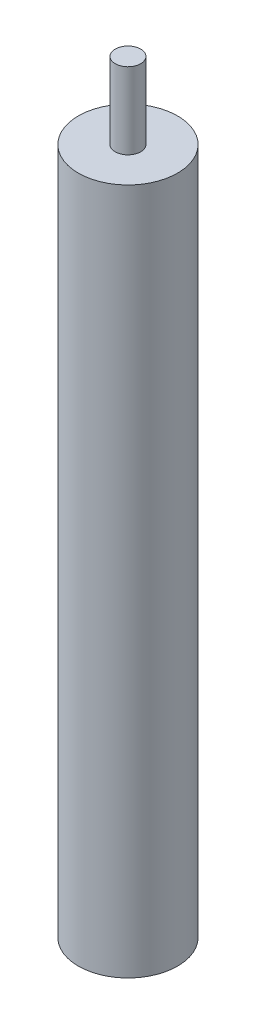
from build123d import *

# Parameters (mm, degrees)
SKETCH1_R           = 1.95
BOSS_EXTRUDE1_DEPTH = 27
SKETCH2_R           = 0.5
BOSS_EXTRUDE2_DEPTH = 3


with BuildPart() as part:
    # Sketch1 → Boss-Extrude1 (new body)
    with BuildSketch(Plane(origin=(0, 0, 0), x_dir=(1, 0, 0), z_dir=(0, 1, 0))):
        with Locations(Location((-2.949240541, 0.333822696, 0), (0, 0, 270))):
            Circle(SKETCH1_R)
    extrude(amount=BOSS_EXTRUDE1_DEPTH)

    # Sketch2 → Boss-Extrude2 (add)
    with BuildSketch(Plane(origin=(0, 27, 0), x_dir=(1, 0, 0), z_dir=(0, 1, 0))):
        with Locations(Location((-2.949240541, 0.333822696, 0), (0, 0, 270))):
            Circle(SKETCH2_R)
    extrude(amount=BOSS_EXTRUDE2_DEPTH)


solid = part.part
